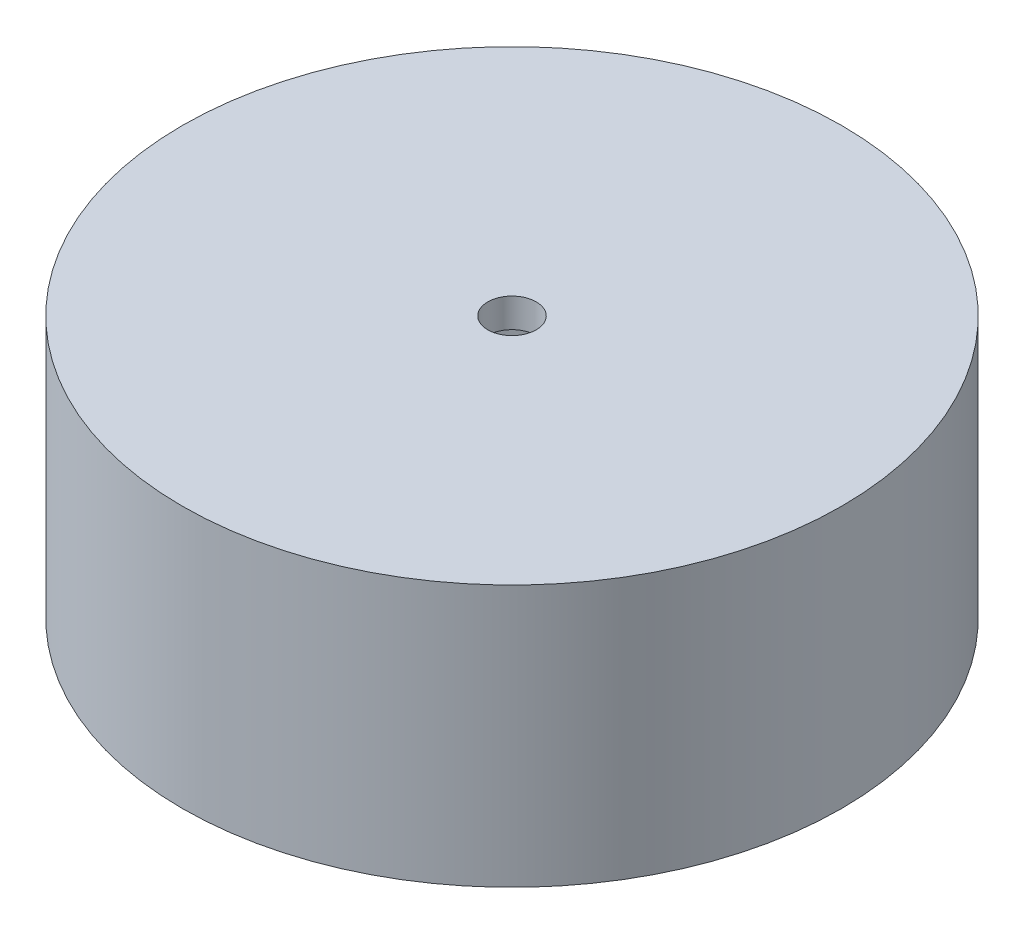
from build123d import *

# Parameters (mm, degrees)
SKETCH1_R               = 8.5
SKETCH1_R_2             = 7
BOSS_EXTRUDE1_DEPTH     = 6
SKETCH2_R               = 8.5
BOSS_EXTRUDE2_DEPTH     = 0.75
CUT_EXTRUDE1_DEPTH      = 14.786315679
CUT_EXTRUDE1_DEPTH_BACK = 14.786315679
SKETCH3_R               = 0.625
FILLET1_R               = 0.5


with BuildPart() as part:
    # Sketch1 → Boss-Extrude1 (new body)
    with BuildSketch(Plane(origin=(0, 0, 0), x_dir=(1, 0, 0), z_dir=(0, 1, 0))):
        with Locations(Location((0, 0, 0), (0, 0, 270))):
            Circle(SKETCH1_R)
        with Locations(Location((0, 0, 0), (0, 0, 270))):
            Circle(SKETCH1_R_2, mode=Mode.SUBTRACT)
    extrude(amount=BOSS_EXTRUDE1_DEPTH)

    # Sketch2 → Boss-Extrude2 (add)
    with BuildSketch(Plane(origin=(0, 6, 0), x_dir=(1, 0, 0), z_dir=(0, 1, 0))):
        with Locations(Location((0, 0, 0), (0, 0, 270))):
            Circle(SKETCH2_R)
    extrude(amount=BOSS_EXTRUDE2_DEPTH)

    # Sketch3 → Cut-Extrude1 (cut, two sides: drawn at the far end of the back side and taken through both)
    with BuildSketch(Plane(origin=(0, 6.75, 0), x_dir=(1, 0, 0), z_dir=(0, 1, 0)).offset(-CUT_EXTRUDE1_DEPTH_BACK)):
        with Locations(Location((0, 0, 0), (0, 0, 270))):
            Circle(SKETCH3_R)
    extrude(amount=CUT_EXTRUDE1_DEPTH + CUT_EXTRUDE1_DEPTH_BACK, mode=Mode.SUBTRACT)

    # Fillet1
    fillet1_edges = [part.edges().sort_by_distance(p)[0] for p in [
        (0, 0, -7),
    ]]
    fillet(fillet1_edges, radius=FILLET1_R)


solid = part.part
